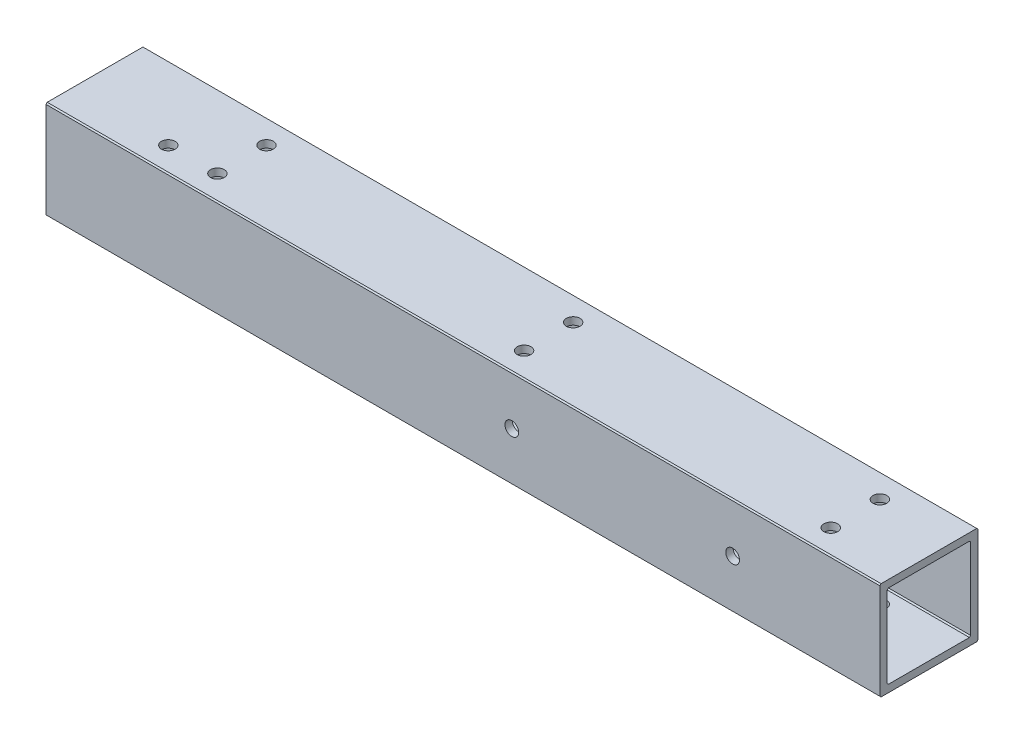
from build123d import *

# Parameters (mm, degrees)
SKETCH1_W                      = 339.85
SKETCH1_H                      = 40
BOSS_EXTRUDE1_DEPTH            = 40
SKETCH2_W                      = 34
SKETCH2_H                      = 34
CUT_EXTRUDE1_DEPTH             = 395.033022093
F_5_6_5_6_DIAMETER_HOLE1_D     = 5.6
F_5_6_5_6_DIAMETER_HOLE1_DEPTH = 3
F_5_6_5_6_DIAMETER_HOLE2_D     = 5.6
F_5_6_5_6_DIAMETER_HOLE2_DEPTH = 3
F_5_6_5_6_DIAMETER_HOLE3_D     = 5.6
F_5_6_5_6_DIAMETER_HOLE4_D     = 5.6
F_5_6_5_6_DIAMETER_HOLE4_DEPTH = 40
CHAMFER1_SIZE                  = 0.5


with BuildPart() as part:
    # Sketch1 → Boss-Extrude1 (new body)
    with BuildSketch(Plane(origin=(0, -102, 0), x_dir=(1, 0, 0), z_dir=(0, 1, 0))):
        with Locations((80.075, -120)):
            Rectangle(SKETCH1_W, SKETCH1_H)
    extrude(amount=-BOSS_EXTRUDE1_DEPTH)

    # Sketch2 → Cut-Extrude1 (cut, through all)
    with BuildSketch(Plane.ZY.offset(89.85)):
        with Locations((120, -122)):
            Rectangle(SKETCH2_W, SKETCH2_H)
    extrude(amount=-CUT_EXTRUDE1_DEPTH, mode=Mode.SUBTRACT)

    # Ø5.6 (5.6) Diameter Hole1
    with Locations(Plane(origin=(0, -139, 0), x_dir=(1, 0, 0), z_dir=(0, 1, 0))):
        with Locations((220, -130), (95, -130), (220, -110), (95, -110), (-30, -130), (-50, -130), (-30, -110)):
            Hole(F_5_6_5_6_DIAMETER_HOLE1_D / 2, depth=F_5_6_5_6_DIAMETER_HOLE1_DEPTH)

    # Ø5.6 (5.6) Diameter Hole2
    with Locations(Plane(origin=(0, 0, 100), x_dir=(-1, 0, 0), z_dir=(0, 0, -1))):
        with Locations((-190, -122), (-100, -122)):
            Hole(F_5_6_5_6_DIAMETER_HOLE2_D / 2, depth=F_5_6_5_6_DIAMETER_HOLE2_DEPTH)

    # Ø5.6 (5.6) Diameter Hole3 (through all)
    with Locations(Plane(origin=(0, 0, 137), x_dir=(-1, 0, 0), z_dir=(0, 0, -1))):
        with Locations((-190, -122), (-100, -122)):
            Hole(F_5_6_5_6_DIAMETER_HOLE3_D / 2)

    # Ø5.6 (5.6) Diameter Hole4
    with Locations(Plane(origin=(0, -102, 0), x_dir=(1, 0, 0), z_dir=(0, 1, 0))):
        with Locations((220, -130), (95, -130), (220, -110), (95, -110), (-30, -130), (-50, -130), (-30, -110)):
            Hole(F_5_6_5_6_DIAMETER_HOLE4_D / 2, depth=F_5_6_5_6_DIAMETER_HOLE4_DEPTH)

    # Chamfer1
    chamfer1_edges = [part.edges().sort_by_distance(p)[0] for p in [
        (80.075, -142, 100),
        (80.075, -139, 103),
        (80.075, -105, 103),
        (80.075, -105, 137),
        (80.075, -139, 137),
        (80.075, -142, 140),
        (80.075, -102, 100),
        (80.075, -102, 140),
    ]]
    chamfer(chamfer1_edges, length=CHAMFER1_SIZE)


solid = part.part
